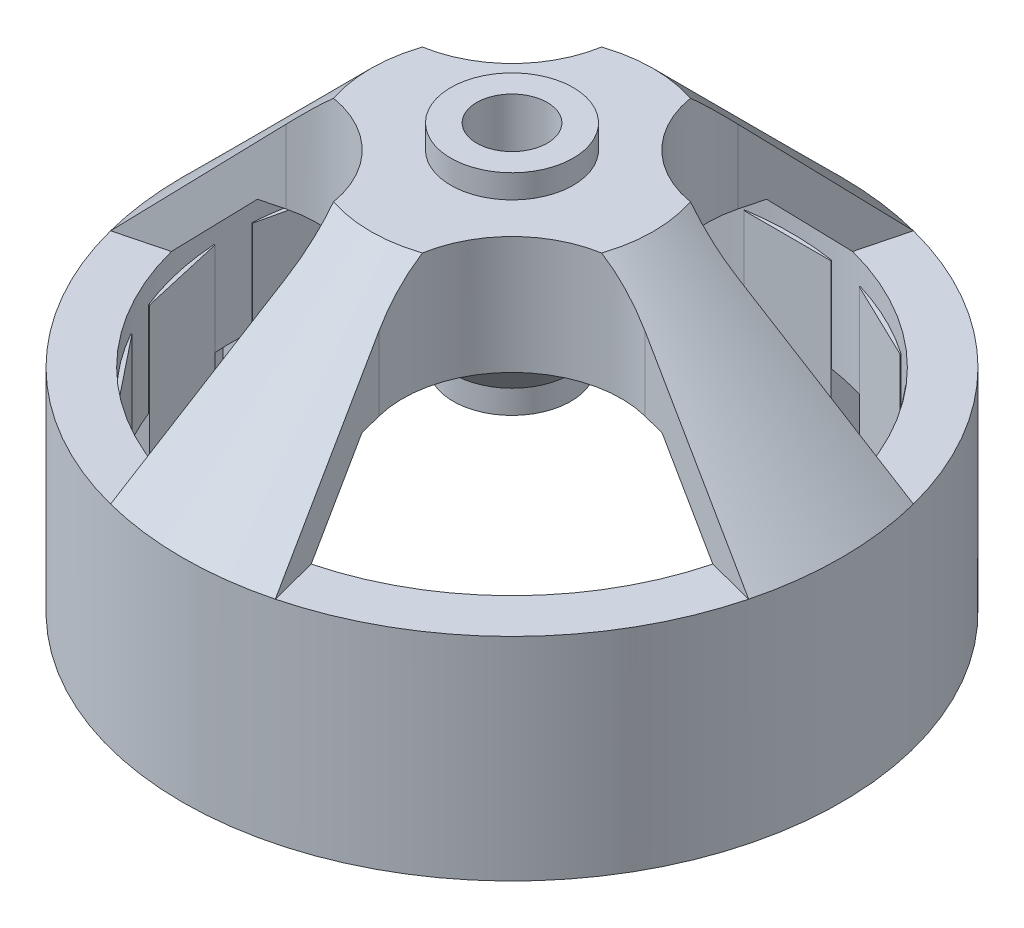
from build123d import *

# Parameters (mm, degrees)
CUT_EXTRUDE1_REACH  = 28.096
SKETCH5_R           = 14
SKETCH5_R_2         = 11.878679656
BOSS_EXTRUDE2_DEPTH = 5
BOSS_EXTRUDE3_START = -1
SKETCH3_W           = 3.7
SKETCH3_H           = 1.8
BOSS_EXTRUDE3_DEPTH = 7


with BuildPart() as part:
    # Sketch1 → Revolve1 (revolve)
    with BuildSketch(Plane.XY, mode=Mode.PRIVATE) as revolve1_sk:
        Polygon((14, 0), (14, 9), (6, 17), (2.6, 17), (2.6, 18), (1.5, 18), (1.5, 9), (2.5, 9), (2.5, 10), (4.5, 12), (8.878679656, 12), (13.5, 7.378679656), (13.5, 0), align=None)
    revolve(revolve1_sk.sketch.rotate(Axis((0, 0, 0), (0, 1, 0)), 90), axis=Axis((0, 0, 0), (0, 1, 0)))

    # Cut-Extrude1: up to this face of the body (flat: up to its plane)
    cut_extrude1_end = Plane(part.part.faces().sort_by_distance((0, 9, 1.570710678))[0])
    # Sketch2 → Cut-Extrude1 (cut, up to the picked face)
    with BuildSketch(Plane(origin=(0, 17, 0), x_dir=(1, 0, 0), z_dir=(0, 1, 0)), mode=Mode.PRIVATE) as cut_extrude1_sk1:
        with BuildLine():
            Line((3.5, 13.555441712), (1.969238681, 7.626828615))
            ThreePointArc((1.969238681, 7.626828615), (3.181980515, 3.181980515), (7.626828615, 1.969238681))
            Line((7.626828615, 1.969238681), (13.555441712, 3.5))
            ThreePointArc((13.555441712, 3.5), (9.899494937, 9.899494937), (3.5, 13.555441712))
        make_face()
    cut_extrude1_tool1 = split(extrude(cut_extrude1_sk1.sketch, amount=-CUT_EXTRUDE1_REACH, mode=Mode.PRIVATE), bisect_by=cut_extrude1_end, keep=Keep.BOTH, mode=Mode.PRIVATE)
    # Sketch2 → Cut-Extrude1 (cut, up to the picked face)
    with BuildSketch(Plane(origin=(0, 17, 0), x_dir=(1, 0, 0), z_dir=(0, 1, 0)), mode=Mode.PRIVATE) as cut_extrude1_sk2:
        with BuildLine():
            Line((13.555441712, -3.5), (7.626828615, -1.969238681))
            ThreePointArc((7.626828615, -1.969238681), (3.181980515, -3.181980515), (1.969238681, -7.626828615))
            Line((1.969238681, -7.626828615), (3.5, -13.555441712))
            ThreePointArc((3.5, -13.555441712), (9.899494937, -9.899494937), (13.555441712, -3.5))
        make_face()
    cut_extrude1_tool2 = split(extrude(cut_extrude1_sk2.sketch, amount=-CUT_EXTRUDE1_REACH, mode=Mode.PRIVATE), bisect_by=cut_extrude1_end, keep=Keep.BOTH, mode=Mode.PRIVATE)
    # Sketch2 → Cut-Extrude1 (cut, up to the picked face)
    with BuildSketch(Plane(origin=(0, 17, 0), x_dir=(1, 0, 0), z_dir=(0, 1, 0)), mode=Mode.PRIVATE) as cut_extrude1_sk3:
        with BuildLine():
            Line((-3.5, -13.555441712), (-1.969238681, -7.626828615))
            ThreePointArc((-1.969238681, -7.626828615), (-3.181980515, -3.181980515), (-7.626828615, -1.969238681))
            Line((-7.626828615, -1.969238681), (-13.555441712, -3.5))
            ThreePointArc((-13.555441712, -3.5), (-9.899494937, -9.899494937), (-3.5, -13.555441712))
        make_face()
    cut_extrude1_tool3 = split(extrude(cut_extrude1_sk3.sketch, amount=-CUT_EXTRUDE1_REACH, mode=Mode.PRIVATE), bisect_by=cut_extrude1_end, keep=Keep.BOTH, mode=Mode.PRIVATE)
    # Sketch2 → Cut-Extrude1 (cut, up to the picked face)
    with BuildSketch(Plane(origin=(0, 17, 0), x_dir=(1, 0, 0), z_dir=(0, 1, 0)), mode=Mode.PRIVATE) as cut_extrude1_sk4:
        with BuildLine():
            Line((-13.555441712, 3.5), (-7.626828615, 1.969238681))
            ThreePointArc((-7.626828615, 1.969238681), (-3.181980515, 3.181980515), (-1.969238681, 7.626828615))
            Line((-1.969238681, 7.626828615), (-3.5, 13.555441712))
            ThreePointArc((-3.5, 13.555441712), (-9.899494937, 9.899494937), (-13.555441712, 3.5))
        make_face()
    cut_extrude1_tool4 = split(extrude(cut_extrude1_sk4.sketch, amount=-CUT_EXTRUDE1_REACH, mode=Mode.PRIVATE), bisect_by=cut_extrude1_end, keep=Keep.BOTH, mode=Mode.PRIVATE)
    add(cut_extrude1_tool1.solids().sort_by(Axis((6.913029, 17, -6.913029), (0, -1, 0)))[0], mode=Mode.SUBTRACT)
    add(cut_extrude1_tool2.solids().sort_by(Axis((6.913029, 17, 6.913029), (0, -1, 0)))[0], mode=Mode.SUBTRACT)
    add(cut_extrude1_tool3.solids().sort_by(Axis((-6.913029, 17, 6.913029), (0, -1, 0)))[0], mode=Mode.SUBTRACT)
    add(cut_extrude1_tool4.solids().sort_by(Axis((-6.913029, 17, -6.913029), (0, -1, 0)))[0], mode=Mode.SUBTRACT)

    # Sketch5 → Boss-Extrude2 (add)
    with BuildSketch(Plane(origin=(0, 9, 0), x_dir=(1, 0, 0), z_dir=(0, 1, 0))):
        with Locations(Location((0, 0, 0), (0, 0, 90))):
            Circle(SKETCH5_R)
        with Locations(Location((0, 0, 0), (0, 0, 284.477512186))):
            Circle(SKETCH5_R_2, mode=Mode.SUBTRACT)
    extrude(amount=-BOSS_EXTRUDE2_DEPTH)

    # Sketch3 → Boss-Extrude3 (add)
    with BuildSketch(Plane.XZ.offset(BOSS_EXTRUDE3_START)):
        with Locations((0, 12.6)):
            Rectangle(SKETCH3_W, SKETCH3_H)
        Polygon((3.409647342, 11.344020672), (6.743232153, 9.738650837), (7.524222884, 11.360394799), (4.190638072, 12.965764634), align=None)
        Polygon((7.993972211, 8.741218924), (10.300884478, 5.848442439), (11.708181147, 6.970724083), (9.40126888, 9.863500568), align=None)
        Polygon((10.994992845, 4.407111565), (11.8183203, 0.79987829), (13.573190542, 1.200415971), (12.749863087, 4.807649246), align=None)
        Polygon((11.8183203, -0.79987829), (10.994992845, -4.407111565), (12.749863087, -4.807649246), (13.573190542, -1.200415971), align=None)
        Polygon((10.300884478, -5.848442439), (7.993972211, -8.741218924), (9.40126888, -9.863500568), (11.708181147, -6.970724083), align=None)
        Polygon((6.743232153, -9.738650837), (3.409647342, -11.344020672), (4.190638072, -12.965764634), (7.524222884, -11.360394799), align=None)
        with Locations((0, -12.6)):
            Rectangle(SKETCH3_W, SKETCH3_H)
        Polygon((-3.409647342, -11.344020672), (-6.743232153, -9.738650837), (-7.524222884, -11.360394799), (-4.190638072, -12.965764634), align=None)
        Polygon((-7.993972211, -8.741218924), (-10.300884478, -5.848442439), (-11.708181147, -6.970724083), (-9.40126888, -9.863500568), align=None)
        Polygon((-10.994992845, -4.407111565), (-11.8183203, -0.79987829), (-13.573190542, -1.200415971), (-12.749863087, -4.807649246), align=None)
        Polygon((-11.8183203, 0.79987829), (-10.994992845, 4.407111565), (-12.749863087, 4.807649246), (-13.573190542, 1.200415971), align=None)
        Polygon((-10.300884478, 5.848442439), (-7.993972211, 8.741218924), (-9.40126888, 9.863500568), (-11.708181147, 6.970724083), align=None)
        Polygon((-6.743232153, 9.738650837), (-3.409647342, 11.344020672), (-4.190638072, 12.965764634), (-7.524222884, 11.360394799), align=None)
    extrude(amount=-BOSS_EXTRUDE3_DEPTH)


solid = part.part
